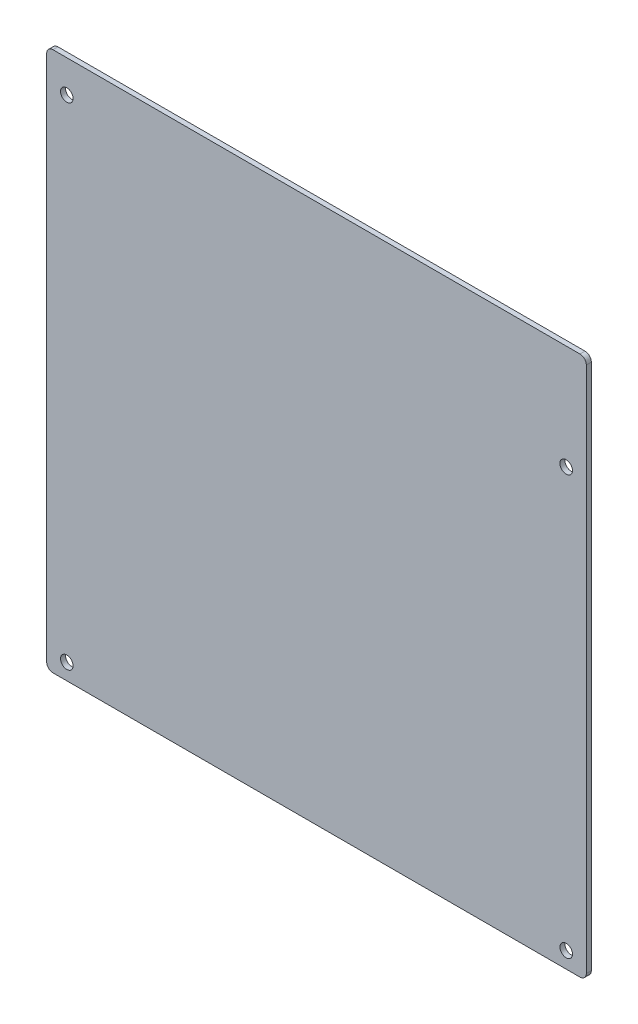
from build123d import *

# Parameters (mm, degrees)
SALIENTE_EXTRUIR1_DEPTH = 1.575
CROQUIS2_R              = 1.975
CORTAR_EXTRUIR1_DEPTH   = 10


with BuildPart() as part:
    # Croquis1 → Saliente-Extruir1 (new body)
    with BuildSketch(Plane.XY):
        with BuildLine():
            Line((161.83, 165.1), (-4.35, 165.1))
            ThreePointArc((-4.35, 165.1), (-5.764213562, 164.514213562), (-6.35, 163.1))
            Line((-6.35, 163.1), (-6.35, -3.08))
            ThreePointArc((-6.35, -3.08), (-5.764213562, -4.494213562), (-4.35, -5.08))
            Line((-4.35, -5.08), (161.83, -5.08))
            ThreePointArc((161.83, -5.08), (163.244213562, -4.494213562), (163.83, -3.08))
            Line((163.83, -3.08), (163.83, 163.1))
            ThreePointArc((163.83, 163.1), (163.244213562, 164.514213562), (161.83, 165.1))
        make_face()
    extrude(amount=-SALIENTE_EXTRUIR1_DEPTH)

    # Croquis2 → Cortar-Extruir1 (cut)
    with BuildSketch(Plane.XY):
        Circle(CROQUIS2_R)
        with Locations((157.48, 0)):
            Circle(CROQUIS2_R)
        with Locations((157.48, 132.08)):
            Circle(CROQUIS2_R)
        with Locations((0, 154.919999989)):
            Circle(CROQUIS2_R)
    extrude(amount=-CORTAR_EXTRUIR1_DEPTH, mode=Mode.SUBTRACT)


solid = part.part
